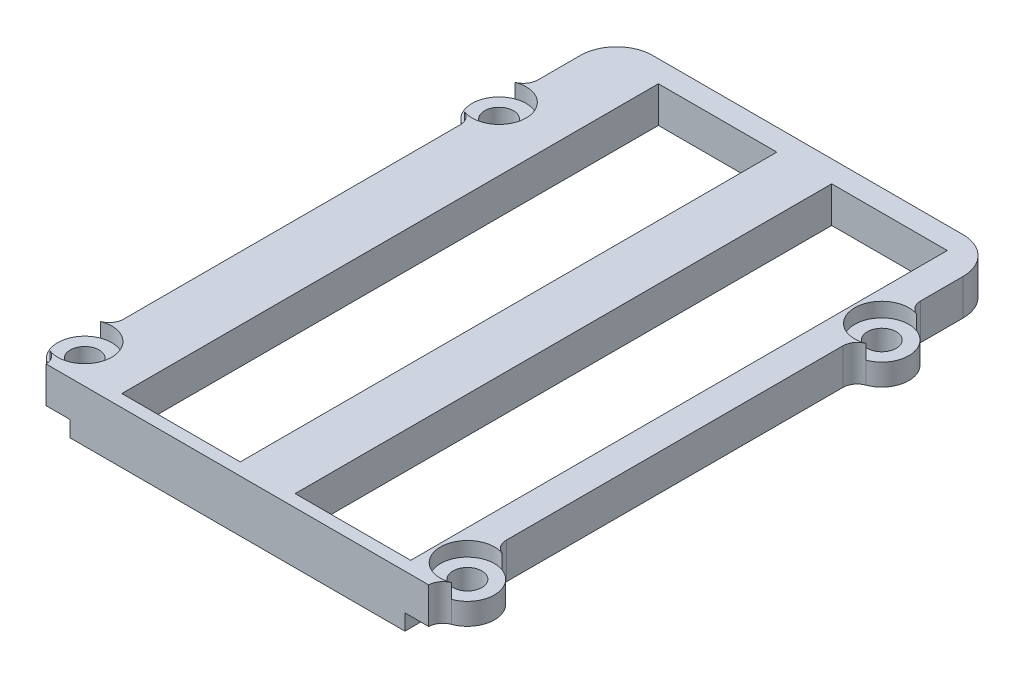
from build123d import *

# Parameters (mm, degrees)
SKETCH2_R           = 2
BOSS_EXTRUDE1_DEPTH = 3
BOSS_EXTRUDE2_DEPTH = 2
FILLET1_R           = 5
SKETCH4_W           = 16
SKETCH4_H           = 74.3
SKETCH4_W_2         = 16.4
CUT_EXTRUDE1_DEPTH  = 10
BOSS_EXTRUDE3_DEPTH = 2.2


with BuildPart() as part:
    # Sketch2 → Boss-Extrude1 (new body)
    with BuildSketch(Plane(origin=(0, 0, 0), x_dir=(1, 0, 0), z_dir=(0, 1, 0))):
        with BuildLine():
            Line((57.160001108, 49.763863032), (4.160001108, 49.763863032))
            Line((4.160001108, 49.763863032), (4.160001108, 38.892058935))
            ThreePointArc((4.160001108, 38.892058935), (3.801845246, 37.749978453), (2.855653282, 37.016940791))
            ThreePointArc((2.855653282, 37.016940791), (0.410001108, 33.501094271), (2.855653282, 29.985247752))
            ThreePointArc((2.855653282, 29.985247752), (3.801845246, 29.25221009), (4.160001108, 28.110129608))
            Line((4.160001108, 28.110129608), (4.160001108, -18.486673333))
            ThreePointArc((4.160001108, -18.486673333), (3.801845246, -19.628753814), (2.855653282, -20.361791477))
            ThreePointArc((2.855653282, -20.361791477), (0.410001109, -23.877730206), (2.855826188, -27.393548657))
            ThreePointArc((2.855826188, -27.393548657), (3.792729548, -28.113251523), (4.160001108, -29.236136968))
            Line((4.160001108, -29.236136968), (7.160001108, -29.236136968))
            Line((7.160001108, -29.236136968), (54.160001108, -29.236136968))
            Line((54.160001108, -29.236136968), (57.160001108, -29.236136968))
            ThreePointArc((57.160001108, -29.236136968), (57.527272669, -28.113251523), (58.464176029, -27.393548657))
            ThreePointArc((58.464176029, -27.393548657), (60.910001107, -23.877730206), (58.464348934, -20.361791477))
            ThreePointArc((58.464348934, -20.361791477), (57.51815697, -19.628753814), (57.160001108, -18.486673333))
            Line((57.160001108, -18.486673333), (57.160001108, 28.110129608))
            ThreePointArc((57.160001108, 28.110129608), (57.51815697, 29.25221009), (58.464348934, 29.985247752))
            ThreePointArc((58.464348934, 29.985247752), (60.910001108, 33.501094271), (58.464348934, 37.016940791))
            ThreePointArc((58.464348934, 37.016940791), (57.51815697, 37.749978453), (57.160001108, 38.892058935))
            Line((57.160001108, 38.892058935), (57.160001108, 49.763863032))
        make_face()
        with Locations(Location((4.160001108, 33.501094271, 0), (0, 0, 270))):
            Circle(SKETCH2_R, mode=Mode.SUBTRACT)
        with Locations(Location((57.160001108, 33.501094271, 0), (0, 0, 270))):
            Circle(SKETCH2_R, mode=Mode.SUBTRACT)
        with Locations(Location((57.160001108, -23.877637996, 0), (0, 0, 270))):
            Circle(SKETCH2_R, mode=Mode.SUBTRACT)
        with Locations(Location((4.160001108, -23.877637996, 0), (0, 0, 270))):
            Circle(SKETCH2_R, mode=Mode.SUBTRACT)
    extrude(amount=BOSS_EXTRUDE1_DEPTH)

    # Sketch3 → Boss-Extrude2 (add)
    with BuildSketch(Plane(origin=(0, 3, 0), x_dir=(1, 0, 0), z_dir=(0, 1, 0))):
        with BuildLine():
            Line((57.160001108, 38.892058935), (57.160001108, 49.763863032))
            Line((57.160001108, 49.763863032), (4.160001108, 49.763863032))
            Line((4.160001108, 49.763863032), (4.160001108, 38.892058935))
            ThreePointArc((4.160001108, 38.892058935), (3.801845246, 37.749978453), (2.855653282, 37.016940791))
            ThreePointArc((2.855653282, 37.016940791), (7.910001108, 33.501094271), (2.855653282, 29.985247752))
            ThreePointArc((2.855653282, 29.985247752), (3.801845246, 29.25221009), (4.160001108, 28.110129608))
            Line((4.160001108, 28.110129608), (4.160001108, -18.486673333))
            ThreePointArc((4.160001108, -18.486673333), (3.801845246, -19.628753814), (2.855653282, -20.361791477))
            ThreePointArc((2.855653282, -20.361791477), (7.910001107, -23.877545787), (2.855826188, -27.393548657))
            ThreePointArc((2.855826188, -27.393548657), (3.792729548, -28.113251523), (4.160001108, -29.236136968))
            Line((4.160001108, -29.236136968), (57.160001108, -29.236136968))
            ThreePointArc((57.160001108, -29.236136968), (57.527272669, -28.113251523), (58.464176029, -27.393548657))
            ThreePointArc((58.464176029, -27.393548657), (53.410001109, -23.877545787), (58.464348934, -20.361791477))
            ThreePointArc((58.464348934, -20.361791477), (57.51815697, -19.628753814), (57.160001108, -18.486673333))
            Line((57.160001108, -18.486673333), (57.160001108, 28.110129608))
            ThreePointArc((57.160001108, 28.110129608), (57.51815697, 29.25221009), (58.464348934, 29.985247752))
            ThreePointArc((58.464348934, 29.985247752), (53.410001108, 33.501094271), (58.464348934, 37.016940791))
            ThreePointArc((58.464348934, 37.016940791), (57.51815697, 37.749978453), (57.160001108, 38.892058935))
        make_face()
    extrude(amount=BOSS_EXTRUDE2_DEPTH)

    # Fillet1
    fillet1_edges = [part.edges().sort_by_distance(p)[0] for p in [
        (4.160001108, 2.5, -49.763863032),
        (57.160001108, 2.5, -49.763863032),
    ]]
    fillet(fillet1_edges, radius=FILLET1_R)

    # Sketch4 → Cut-Extrude1 (cut)
    with BuildSketch(Plane(origin=(0, 5, 0), x_dir=(1, 0, 0), z_dir=(0, 1, 0))):
        with Locations((44.960001108, 9.613863032)):
            Rectangle(SKETCH4_W, SKETCH4_H)
        with Locations((21.160001108, 9.613863032)):
            Rectangle(SKETCH4_W_2, SKETCH4_H)
    extrude(amount=-CUT_EXTRUDE1_DEPTH, mode=Mode.SUBTRACT)

    # Sketch7 → Boss-Extrude3 (add)
    with BuildSketch(Plane.XZ):
        Polygon((53.860001108, 29.236136968), (53.860001108, -43.805670275), (52.960001108, -43.805670275), (52.960001108, 27.536136968), (8.460001108, 27.536136968), (8.460001108, -43.805670275), (7.460001108, -43.805670275), (7.460001108, 29.236136968), align=None)
    extrude(amount=BOSS_EXTRUDE3_DEPTH)


solid = part.part
